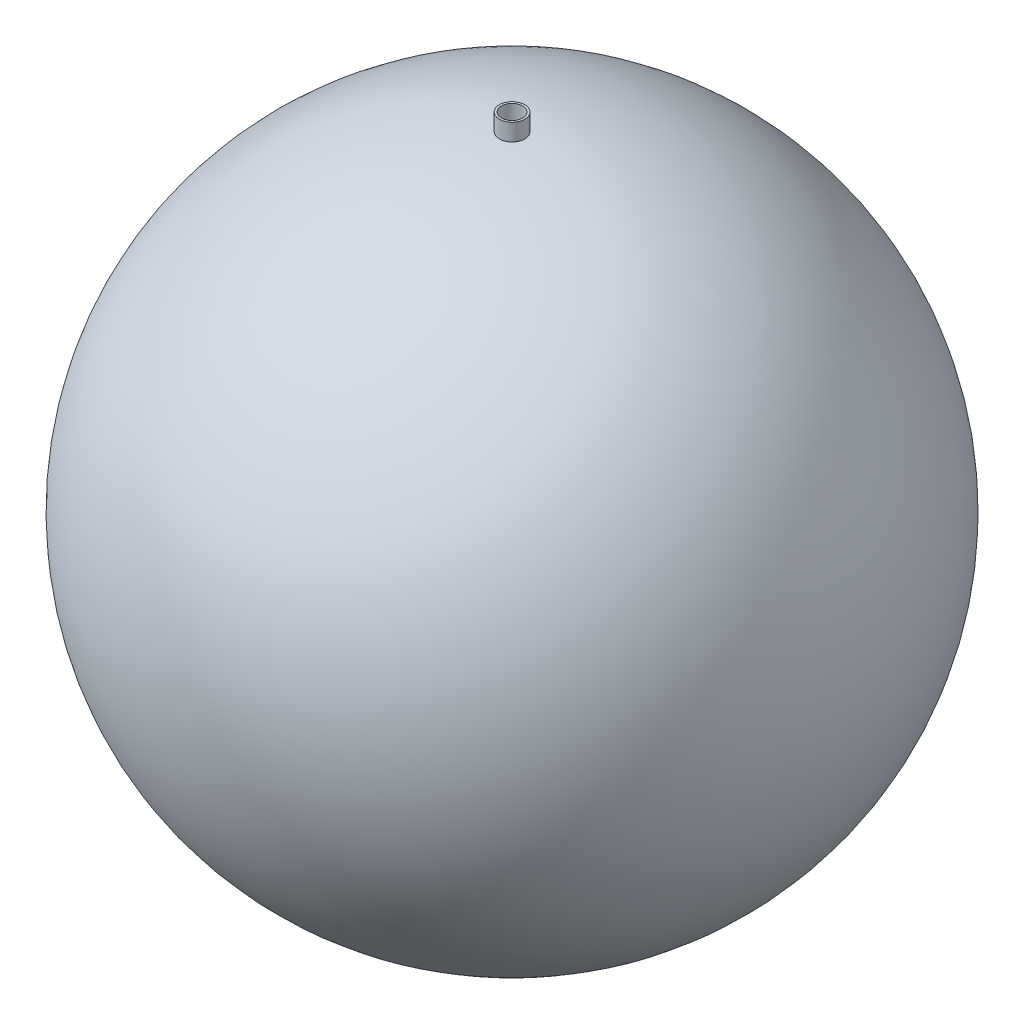
from build123d import *

# Parameters (mm, degrees)
SKETCH76_R          = 30
BOSS_EXTRUDE1_DEPTH = 50
SKETCH78_R          = 25
CUT_EXTRUDE1_DEPTH  = 1378.239234241


with BuildPart() as part:
    # Sketch74 → Revolve4 (revolve)
    with BuildSketch(Plane.XY):
        with BuildLine():
            Line((0, 781.5925), (0, 771.5925))
            ThreePointArc((0, 771.5925), (771.5925, 0), (0, -771.5925))
            Line((0, -771.5925), (0, -781.5925))
            ThreePointArc((0, -781.5925), (781.5925, 0), (0, 781.5925))
        make_face()
    revolve(axis=Axis((0, 0, 0), (0, 1, 0)))

    # Sketch76 → Boss-Extrude1 (add)
    with BuildSketch(Plane(origin=(0, 771.5925, 0), x_dir=(1, 0, 0), z_dir=(0, 1, 0))):
        with Locations(Location((0, 0, 0), (0, 0, 90))):
            Circle(SKETCH76_R)
    extrude(amount=BOSS_EXTRUDE1_DEPTH)

    # Sketch78 → Cut-Extrude1 (cut, through all)
    with BuildSketch(Plane(origin=(0, 0, 0), x_dir=(1, 0, 0), z_dir=(0, 1, 0))):
        with Locations(Location((0, 0, 0), (0, 0, 90))):
            Circle(SKETCH78_R)
    extrude(amount=CUT_EXTRUDE1_DEPTH, mode=Mode.SUBTRACT)


solid = part.part
